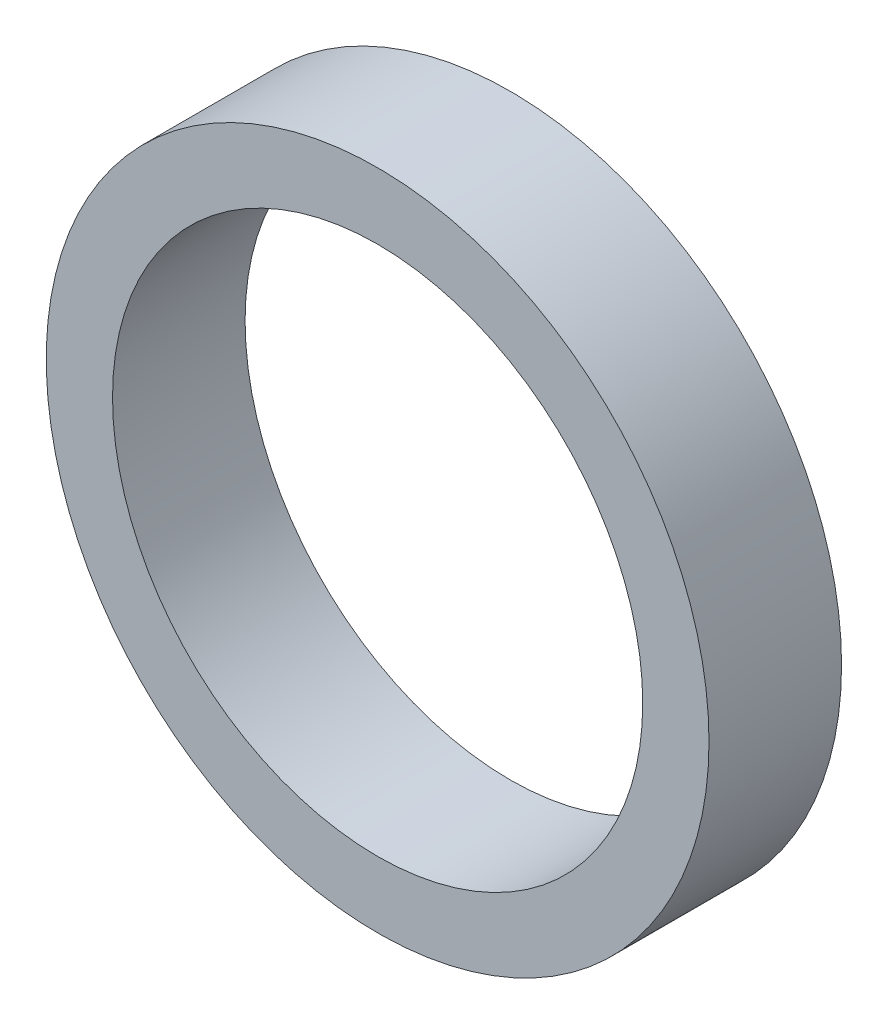
from build123d import *

# Parameters (mm, degrees)
SKETCH1_R           = 31.75
BOSS_EXTRUDE1_DEPTH = 12.7
SKETCH2_R           = 25.4
CUT_EXTRUDE1_DEPTH  = 47.6627796


with BuildPart() as part:
    # Sketch1 → Boss-Extrude1 (new body)
    with BuildSketch(Plane.XY):
        Circle(SKETCH1_R)
    extrude(amount=BOSS_EXTRUDE1_DEPTH)

    # Sketch2 → Cut-Extrude1 (cut, through all)
    with BuildSketch(Plane.XY.offset(12.7)):
        Circle(SKETCH2_R)
    extrude(amount=-CUT_EXTRUDE1_DEPTH, mode=Mode.SUBTRACT)


solid = part.part
